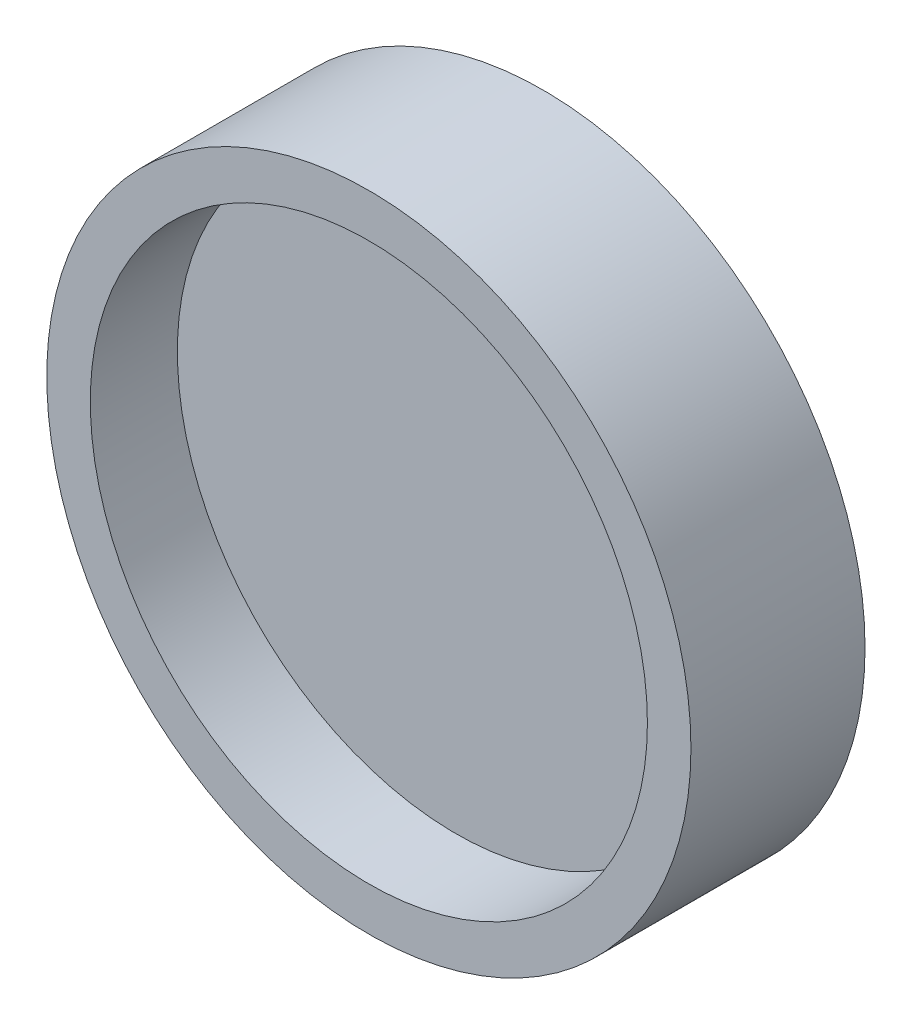
from build123d import *

# Parameters (mm, degrees)
SKETCH1_R           = 74
BOSS_EXTRUDE1_DEPTH = 40
SKETCH2_R           = 64
CUT_EXTRUDE1_DEPTH  = 20


with BuildPart() as part:
    # Sketch1 → Boss-Extrude1 (new body)
    with BuildSketch(Plane.XY):
        Circle(SKETCH1_R)
    extrude(amount=BOSS_EXTRUDE1_DEPTH)

    # Sketch2 → Cut-Extrude1 (cut)
    with BuildSketch(Plane.XY.offset(40)):
        Circle(SKETCH2_R)
    extrude(amount=-CUT_EXTRUDE1_DEPTH, mode=Mode.SUBTRACT)


solid = part.part
